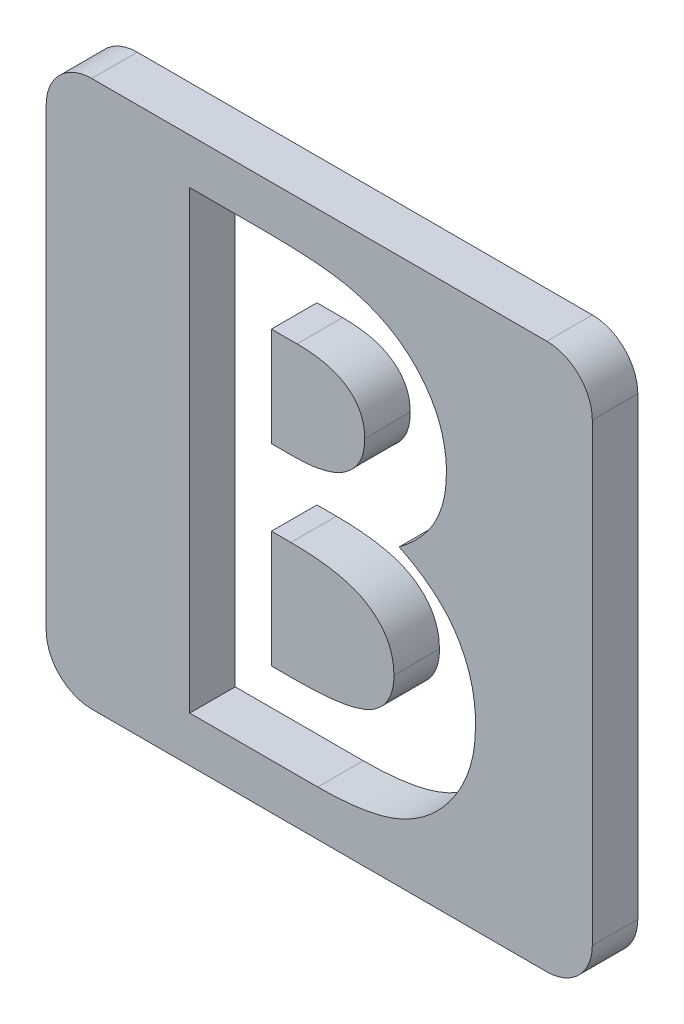
from build123d import *

# Parameters (mm, degrees)
BOSS_EXTRUDE1_DEPTH = 10
CUT_EXTRUDE15_DEPTH = 10


with BuildPart() as part:
    # Sketch1 → Boss-Extrude1 (new body)
    with BuildSketch(Plane.XY):
        with BuildLine():
            Line((-50, 60), (50, 60))
            ThreePointArc((50, 60), (57.071067812, 57.071067812), (60, 50))
            Line((60, 50), (60, -50))
            ThreePointArc((60, -50), (57.071067812, -57.071067812), (50, -60))
            Line((50, -60), (-50, -60))
            ThreePointArc((-50, -60), (-57.071067812, -57.071067812), (-60, -50))
            Line((-60, -50), (-60, 50))
            ThreePointArc((-60, 50), (-57.071067812, 57.071067812), (-50, 60))
        make_face()
    extrude(amount=BOSS_EXTRUDE1_DEPTH)

    # Sketch2 → Cut-Extrude15 (cut)
    with BuildSketch(Plane.XY.offset(10)):
        with BuildLine():
            Line((-28.461538462, -50), (-28.461538462, 50))
            Line((-28.461538462, 50), (-12.435897436, 50))
            add(Edge.make_bspline(
                [(-12.435897436, 50), (-11.31400236, 50.000128036), (-9.143156658, 50.000375783), (-6.011192849, 49.890391497), (-3.106560919, 49.748114501), (-0.438504531, 49.588939628), (1.99751753, 49.31464952), (4.197800896, 49.025577707), (6.166741746, 48.676974917), (7.384030882, 48.364267414), (7.956730769, 48.217147436)],
                knots=[0, 0, 0, 0, 1.311965854, 2.538629056, 3.664479157, 4.713267157, 5.663616078, 6.530575999, 7.308677837, 8, 8, 8, 8], degree=3))
            add(Edge.make_bspline(
                [(7.956730769, 48.217147436), (8.708743867, 48.009632086), (10.184434982, 47.602420351), (12.298095584, 46.780038653), (14.303197505, 45.865903091), (16.197292569, 44.823045384), (17.968750279, 43.638875319), (19.610838491, 42.303994965), (21.158972986, 40.871986363), (22.558183042, 39.302939838), (23.822838395, 37.644951536), (24.921597155, 35.898455894), (25.87627769, 34.09015797), (26.640272179, 32.197301538), (27.215927674, 30.228603714), (27.636959701, 28.192471141), (27.909845467, 26.082460996), (27.935629593, 24.646952129), (27.948717949, 23.918269231)],
                knots=[0, 0, 0, 0, 1.099996261, 2.158545794, 3.195537121, 4.207578794, 5.205712374, 6.197378256, 7.190519799, 8.17788031, 9.159561366, 10.129234751, 11.085776129, 12.040971148, 13.00380137, 13.975669004, 14.972423361, 16, 16, 16, 16], degree=3))
            add(Edge.make_bspline(
                [(27.948717949, 23.918269231), (27.914495785, 22.982102975), (27.847133662, 21.139374723), (27.416819828, 18.432740311), (26.609914344, 15.874581757), (25.554098144, 13.417753165), (24.118518204, 11.071418524), (22.295609324, 8.836693451), (20.114896658, 6.644767409), (18.442169661, 5.3308556), (17.572115385, 4.647435897)],
                knots=[0, 0, 0, 0, 0.986156485, 1.941127874, 2.875419072, 3.804401753, 4.751181392, 5.761612777, 6.835722519, 8, 8, 8, 8], degree=3))
            add(Edge.make_bspline(
                [(17.572115385, 4.647435897), (18.27716563, 4.287513861), (19.659574098, 3.581806327), (21.622187994, 2.421833806), (23.439354226, 1.188055915), (25.119220416, -0.09470324), (26.626549448, -1.480821676), (28.023581469, -2.890429347), (29.24139417, -4.40429091), (30.330398991, -5.968449455), (31.276944281, -7.605554181), (32.101280853, -9.312840386), (32.797568386, -11.096140531), (33.387202678, -12.946379062), (33.826952089, -14.869919934), (34.113678057, -16.867451086), (34.33321338, -18.932159921), (34.350291165, -20.338588018), (34.358974359, -21.053685897)],
                knots=[0, 0, 0, 0, 1.164658916, 2.283573913, 3.35186032, 4.395461096, 5.390182219, 6.362969632, 7.312859996, 8.245001507, 9.165155236, 10.092416118, 11.032087915, 11.979892451, 12.947605196, 13.931445124, 14.948243989, 16, 16, 16, 16], degree=3))
            add(Edge.make_bspline(
                [(34.358974359, -21.053685897), (34.302626235, -22.419481961), (34.191423437, -25.114875014), (33.378362843, -29.072331055), (31.968774121, -32.824358323), (30.075987135, -36.356044655), (27.74370939, -39.56515353), (25.062258807, -42.376305044), (22.058631442, -44.755882393), (19.287422161, -46.361912502), (16.890544368, -47.439708888), (14.905255274, -48.106070581), (12.773096869, -48.723387047), (10.455013131, -49.156879415), (7.993027757, -49.553659299), (5.363136234, -49.798639418), (2.570253782, -49.964656408), (0.651981386, -49.987980619), (-0.336538462, -50)],
                knots=[0, 0, 0, 0, 1.284142165, 2.534249414, 3.780121997, 5.041676246, 6.291546858, 7.49970053, 8.684500223, 9.883330709, 10.50184324, 11.153274765, 11.851151195, 12.587658647, 13.369265475, 14.195992086, 15.070362669, 16, 16, 16, 16], degree=3))
            Line((-0.336538462, -50), (-28.461538462, -50))
        make_face()
        with BuildLine():
            Line((-10.512820513, 32.051282051), (-10.512820513, 10.256410256))
            Line((-10.512820513, 10.256410256), (-5.745192308, 10.256410256))
            add(Edge.make_bspline(
                [(-5.745192308, 10.256410256), (-5.0972288, 10.262060743), (-3.846374462, 10.272968667), (-2.039648051, 10.413458929), (-0.359684264, 10.653144043), (1.187145157, 10.987565071), (2.615249492, 11.412231018), (3.915505598, 11.923195608), (5.082196484, 12.546627947), (6.437621453, 13.475257927), (7.87040339, 14.841778518), (9.131665215, 16.816000643), (9.874540008, 19.086348576), (9.957276223, 20.687573733), (10, 21.514423077)],
                knots=[0, 0, 0, 0, 1.065314748, 2.056525647, 2.977365736, 3.853934255, 4.656397591, 5.425096493, 6.14721249, 6.826394842, 8.123232004, 9.372140726, 10.643011755, 12, 12, 12, 12], degree=3))
            add(Edge.make_bspline(
                [(10, 21.514423077), (9.965813157, 22.288904867), (9.899714271, 23.786334284), (9.151734868, 25.888858547), (7.989974981, 27.75212535), (6.618354145, 29.027379101), (5.326706599, 29.898339815), (4.220718708, 30.471830356), (3.006813948, 30.985213227), (1.661492425, 31.377758282), (0.19243666, 31.67231027), (-1.39321732, 31.88862343), (-3.098205318, 32.035855369), (-4.275844156, 32.046029524), (-4.883814103, 32.051282051)],
                knots=[0, 0, 0, 0, 1.347982417, 2.606269829, 3.849316587, 5.153353503, 5.842674298, 6.568177932, 7.326619318, 8.142485038, 9.012069166, 9.942760135, 10.937925643, 12, 12, 12, 12], degree=3))
            Line((-4.883814103, 32.051282051), (-10.512820513, 32.051282051))
        make_face(mode=Mode.SUBTRACT)
        with BuildLine():
            Line((-10.512820513, -6.41025641), (-10.512820513, -32.051282051))
            Line((-10.512820513, -32.051282051), (-5.344551282, -32.051282051))
            add(Edge.make_bspline(
                [(-5.344551282, -32.051282051), (-4.322777875, -32.045444698), (-2.358290998, -32.034221657), (0.455832973, -31.898620639), (3.014575193, -31.654223695), (5.311155962, -31.349113799), (7.349092928, -30.935737612), (9.121497375, -30.410182767), (10.652675534, -29.831980898), (11.933446385, -29.117832939), (12.979762798, -28.286741812), (13.923953659, -27.437346715), (14.693788053, -26.457489223), (15.302895391, -25.389231902), (15.830076717, -24.259111036), (16.148035265, -23.02299581), (16.390117744, -21.717521716), (16.403440191, -20.814553517), (16.41025641, -20.352564103)],
                knots=[0, 0, 0, 0, 1.753078804, 3.370512758, 4.83203934, 6.162291463, 7.344201807, 8.395507345, 9.331626367, 10.147333109, 10.898971645, 11.62040215, 12.321813352, 13.025280112, 13.727906689, 14.453419512, 15.208716525, 16, 16, 16, 16], degree=3))
            add(Edge.make_bspline(
                [(16.41025641, -20.352564103), (16.39522469, -19.824271941), (16.365946943, -18.795300927), (16.126835227, -17.291349977), (15.692291132, -15.887311977), (15.144961643, -14.547283783), (14.383323578, -13.319243071), (13.478142767, -12.160692009), (12.384453267, -11.110862712), (11.154535621, -10.10625758), (9.719958456, -9.22667136), (8.080048709, -8.463474513), (6.225897499, -7.826080612), (4.151761396, -7.318587171), (1.866733252, -6.887884501), (-0.645865129, -6.630707462), (-3.365107955, -6.439433595), (-5.250675184, -6.420203131), (-6.225961538, -6.41025641)],
                knots=[0, 0, 0, 0, 0.845221588, 1.646264278, 2.427170338, 3.19324141, 3.95557735, 4.731569926, 5.540061037, 6.376114724, 7.268642756, 8.224665384, 9.265483498, 10.400594375, 11.639216012, 12.983232105, 14.439614077, 16, 16, 16, 16], degree=3))
            Line((-6.225961538, -6.41025641), (-10.512820513, -6.41025641))
        make_face(mode=Mode.SUBTRACT)
    extrude(amount=-CUT_EXTRUDE15_DEPTH, mode=Mode.SUBTRACT)


with BuildPart() as cut_extrude15_piece_1:
    # of the separate pieces the step leaves, piece 1, a body of its own (cut_extrude15_pieces)
    add(part.part.solids().sort_by_distance((-50, 60, 0))[0])


with BuildPart() as cut_extrude15_piece_2:
    # of the separate pieces the step leaves, piece 2, a body of its own (cut_extrude15_pieces)
    add(part.part.solids().sort_by_distance((-10.512820513, -6.41025641, 0))[0])


with BuildPart() as cut_extrude15_piece_3:
    # of the separate pieces the step leaves, piece 3, a body of its own (cut_extrude15_pieces)
    add(part.part.solids().sort_by_distance((-10.512820513, 32.051282051, 0))[0])


solid = Compound([cut_extrude15_piece_1.part, cut_extrude15_piece_2.part, cut_extrude15_piece_3.part])
